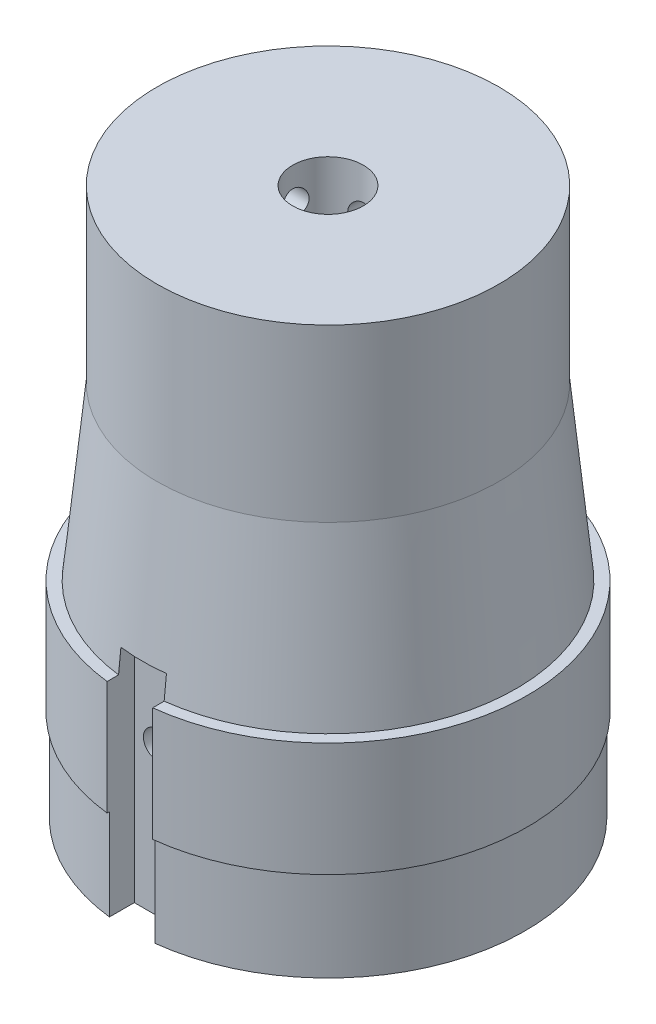
from build123d import *

# Parameters (mm, degrees)
CROQUIS1_W            = 17.3
CROQUIS1_H            = 8
CROQUIS2_W            = 4
CROQUIS2_H            = 3
CORTAR_EXTRUIR3_DEPTH = 20
CROQUIS3_R            = 2.5
CORTAR_EXTRUIR2_DEPTH = 10
CROQUIS4_R            = 1.15
CORTAR_EXTRUIR4_DEPTH = 20
CROQUIS5_R            = 1.2
CORTAR_EXTRUIR5_DEPTH = 20
CROQUIS8_R            = 1.2
CORTAR_EXTRUIR6_DEPTH = 10


with BuildPart() as part:
    # Croquis1 → Revolucion Cuerpo (revolve)
    with BuildSketch(Plane.XY, mode=Mode.PRIVATE) as revolucion_cuerpo_sk:
        Polygon((15, 40), (3.1, 40), (3.1, 24), (0, 24), (0, 0), (17.3, 0), (17.5, 0), (17.5, 10), (16.5, 10), (15, 25), align=None)
        with Locations((8.65, -4)):
            Rectangle(CROQUIS1_W, CROQUIS1_H)
    revolve(revolucion_cuerpo_sk.sketch.rotate(Axis((0, 63.347137848, 0), (0, -1, 0)), 90), axis=Axis((0, 63.347137848, 0), (0, -1, 0)))

    # Croquis2 → Cortar-Extruir3 (cut)
    with BuildSketch(Plane.XZ.offset(8)):
        with Locations((0, 16.5)):
            Rectangle(CROQUIS2_W, CROQUIS2_H)
    extrude(amount=-CORTAR_EXTRUIR3_DEPTH, mode=Mode.SUBTRACT)

    # Croquis3 → Cortar-Extruir2 (cut)
    with BuildSketch(Plane.XZ.offset(8)):
        with Locations(Location((0, 0, 0), (0, 0, 270))):
            Circle(CROQUIS3_R)
    extrude(amount=-CORTAR_EXTRUIR2_DEPTH, mode=Mode.SUBTRACT)

    # Croquis4 → Cortar-Extruir4 (cut)
    with BuildSketch(Plane.XY):
        with Locations((0, 28)):
            Circle(CROQUIS4_R)
        with Locations((0, 36)):
            Circle(CROQUIS4_R)
    extrude(amount=-CORTAR_EXTRUIR4_DEPTH, mode=Mode.SUBTRACT)

    # Croquis5 → Cortar-Extruir5 (cut)
    with BuildSketch(Plane(origin=(0, 0, 0), x_dir=(0, 0, -1), z_dir=(1, 0, 0))):
        with Locations((0, 29)):
            Circle(CROQUIS5_R)
        with Locations((0, 37)):
            Circle(CROQUIS5_R)
    extrude(amount=-CORTAR_EXTRUIR5_DEPTH, mode=Mode.SUBTRACT)

    # Croquis8 → Cortar-Extruir6 (cut)
    with BuildSketch(Plane.XY.offset(15)):
        with Locations((0, 5)):
            Circle(CROQUIS8_R)
    extrude(amount=-CORTAR_EXTRUIR6_DEPTH, mode=Mode.SUBTRACT)


solid = part.part
